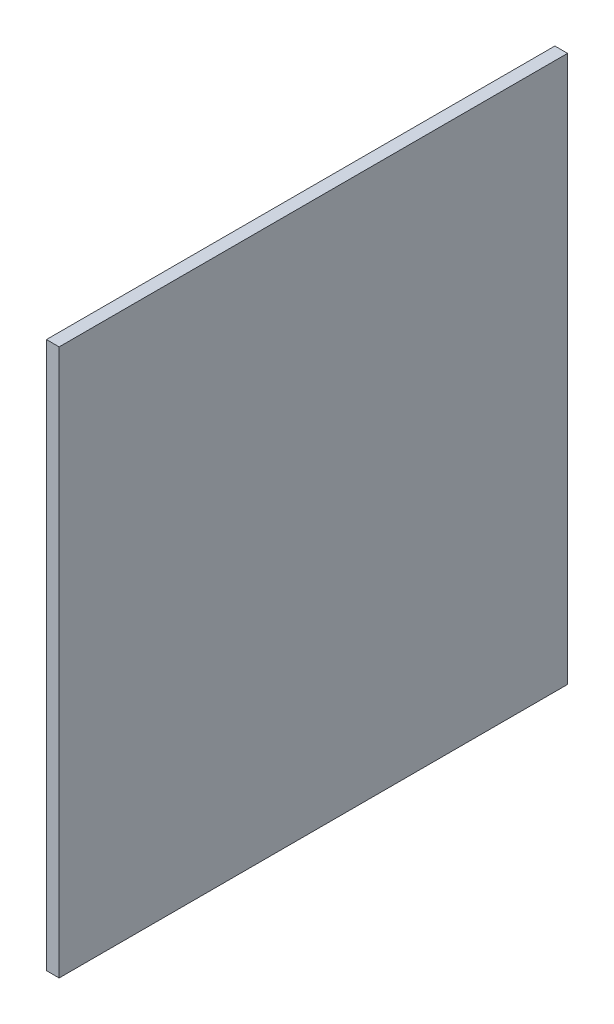
from build123d import *

# Parameters (mm, degrees)
SKETCH_1_W      = 200
SKETCH_1_H      = 215
EXTRUDE_1_DEPTH = 5


with BuildPart() as part:
    # 스케치1 → 보스-돌출1 (new body)
    with BuildSketch(Plane(origin=(0, 0, 0), x_dir=(0, 0, -1), z_dir=(1, 0, 0))):
        with Locations((100, 107.5)):
            Rectangle(SKETCH_1_W, SKETCH_1_H)
    extrude(amount=EXTRUDE_1_DEPTH)


solid = part.part
